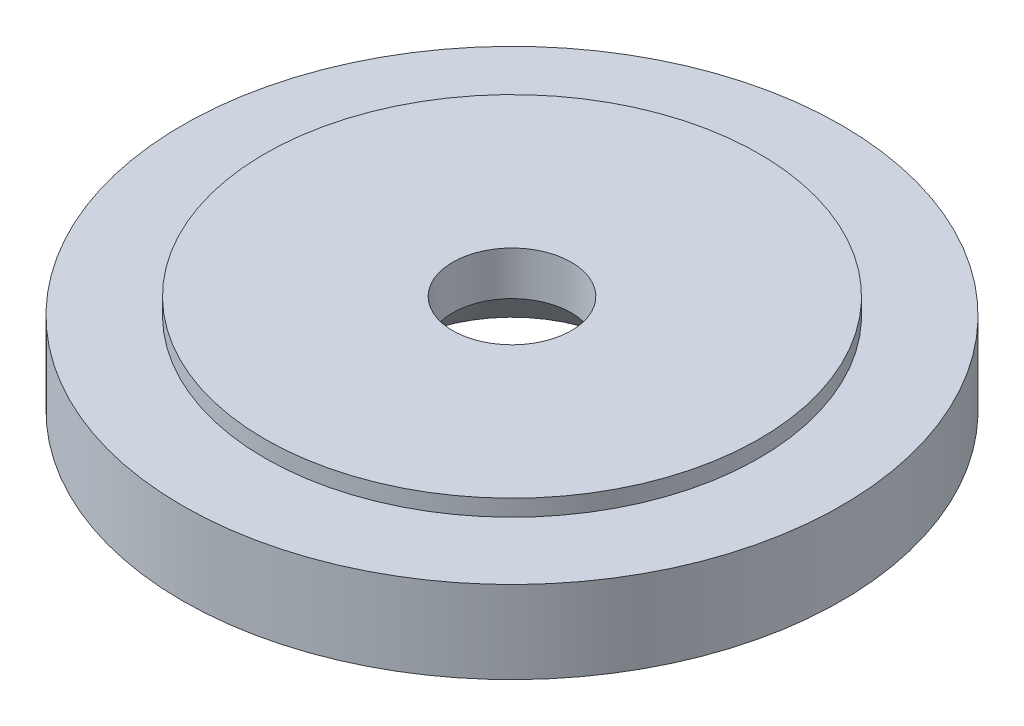
from build123d import *

# Parameters (mm, degrees)
SKETCH1_R           = 10
BOSS_EXTRUDE1_DEPTH = 2.5
SKETCH2_R           = 7.5
BOSS_EXTRUDE2_DEPTH = 0.5


with BuildPart() as part:
    # Sketch1 → Boss-Extrude1 (new body)
    with BuildSketch(Plane(origin=(0, 0, 0), x_dir=(1, 0, 0), z_dir=(0, 1, 0))):
        with Locations(Location((0, 0, 0), (0, 0, 270))):
            Circle(SKETCH1_R)
    extrude(amount=BOSS_EXTRUDE1_DEPTH)

    # Sketch2 → Boss-Extrude2 (add)
    with BuildSketch(Plane(origin=(0, 2.5, 0), x_dir=(1, 0, 0), z_dir=(0, 1, 0))):
        with Locations(Location((0, 0, 0), (0, 0, 270))):
            Circle(SKETCH2_R)
    extrude(amount=BOSS_EXTRUDE2_DEPTH)

    # Sketch4 → CSK for M3 Hex Socket Countersunk Head Screw1 (revolve, cut)
    with BuildSketch(Plane(origin=(0, 0, 0), x_dir=(0, 0, -1), z_dir=(1, 0, 0))):
        Polygon((0, 0), (0, 3), (1.8, 3), (1.8, 1.67), (3.47, 0), align=None)
    revolve(axis=Axis((0, -6.35, 0), (0, 1, 0)), mode=Mode.SUBTRACT)


solid = part.part
